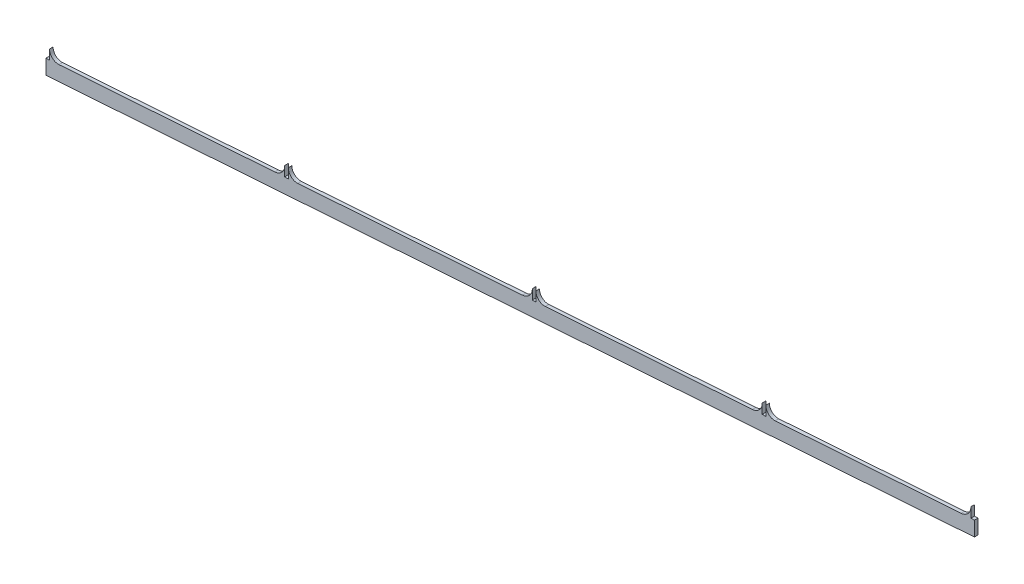
from build123d import *

# Parameters (mm, degrees)
EXTRUDE_1_DEPTH = 2


with BuildPart() as part:
    # 草图1 → 凸台-拉伸1 (new body)
    with BuildSketch(Plane.XY):
        with BuildLine():
            Line((5.593665372, 13.939609945), (3.593665372, 13.939609945))
            Line((3.593665372, 13.939609945), (3.593665372, 5.539609945))
            Line((3.593665372, 5.539609945), (528.593665372, 41.925528217))
            Line((528.593665372, 41.925528217), (528.593665372, 50.186915195))
            Line((528.593665372, 50.186915195), (526.593665372, 50.186915195))
            Line((526.593665372, 50.186915195), (526.593665372, 55.785469044))
            ThreePointArc((526.593665372, 55.785469044), (524.980524361, 51.692124664), (521.008509302, 49.799827515))
            Line((521.008509302, 49.799827515), (415.939368647, 42.517851963))
            ThreePointArc((415.939368647, 42.517851963), (412.182545056, 43.850170746), (410.593665372, 47.50588657))
            Line((410.593665372, 47.50588657), (410.593665372, 42.008746898))
            Line((410.593665372, 42.008746898), (408.593665372, 42.008746898))
            Line((408.593665372, 42.008746898), (408.593665372, 47.607300746))
            ThreePointArc((408.593665372, 47.607300746), (406.980524361, 43.513956367), (403.008509302, 41.621659217))
            Line((403.008509302, 41.621659217), (285.939368647, 33.508005533))
            ThreePointArc((285.939368647, 33.508005533), (282.182545056, 34.840324317), (280.593665372, 38.496040141))
            Line((280.593665372, 38.496040141), (280.593665372, 32.998900469))
            Line((280.593665372, 32.998900469), (278.593665372, 32.998900469))
            Line((278.593665372, 32.998900469), (278.593665372, 38.597454317))
            ThreePointArc((278.593665372, 38.597454317), (276.980524361, 34.504109938), (273.008509302, 32.611812788))
            Line((273.008509302, 32.611812788), (145.939368647, 23.805093994))
            ThreePointArc((145.939368647, 23.805093994), (142.182545056, 25.137412778), (140.593665372, 28.793128602))
            Line((140.593665372, 28.793128602), (140.593665372, 23.29598893))
            Line((140.593665372, 23.29598893), (138.593665372, 23.29598893))
            Line((138.593665372, 23.29598893), (138.593665372, 28.894542778))
            ThreePointArc((138.593665372, 28.894542778), (136.980524361, 24.801198399), (133.008509302, 22.908901249))
            Line((133.008509302, 22.908901249), (10.939368647, 14.44871501))
            ThreePointArc((10.939368647, 14.44871501), (7.182545056, 15.781033793), (5.593665372, 19.436749618))
            Line((5.593665372, 19.436749618), (5.593665372, 13.939609945))
        make_face()
    extrude(amount=EXTRUDE_1_DEPTH)


solid = part.part
